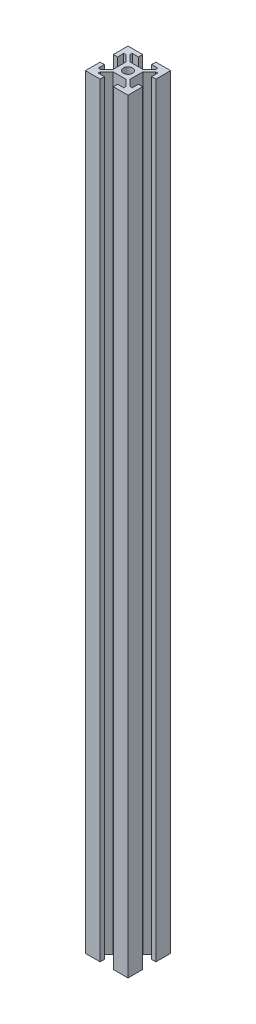
from build123d import *

# Parameters (mm, degrees)
SKETCH_1_R          = 2.15
EXTRUDE_1_DEPTH     = 359
SKETCH_3_R          = 3
CUT_EXTRUDE_1_DEPTH = 26


with BuildPart() as part:
    # 스케치1 → 보스-돌출1 (new body)
    with BuildSketch(Plane(origin=(0, 0, 0), x_dir=(1, 0, 0), z_dir=(0, 1, 0))):
        Polygon((3.1, 8), (6, 8), (6, 7), (3, 4), (0, 4), (-3, 4), (-6, 7), (-6, 8), (-3.1, 8), (-3.1, 9.998992087), (-10.001007855, 9.998992087), (-10.001007855, 3.1), (-8, 3.1), (-8, 6), (-7, 6), (-4, 3), (-4, 0), (-4, -3), (-7, -6), (-8, -6), (-8, -3.1), (-10.001007855, -3.1), (-10.001007855, -9.998992087), (-3.1, -9.998992087), (-3.1, -8), (-6, -8), (-6, -7), (-3, -4), (0, -4), (3, -4), (6, -7), (6, -8), (3.1, -8), (3.1, -9.998992087), (10.001007855, -9.998992087), (10.001007855, -3.1), (8, -3.1), (8, -6), (7, -6), (4, -3), (4, 0), (4, 3), (7, 6), (8, 6), (8, 3.1), (10.001007855, 3.1), (10.001007855, 9.998992087), (3.1, 9.998992087), align=None)
        with Locations(Location((0, 0, 0), (0, 0, 270))):
            Circle(SKETCH_1_R, mode=Mode.SUBTRACT)
    extrude(amount=EXTRUDE_1_DEPTH)

    # 스케치3 → 컷-돌출1 (cut)
    with BuildSketch(Plane(origin=(10.001007855, 0, 0), x_dir=(0, 0, -1), z_dir=(1, 0, 0))):
        with Locations((0, 179.5)):
            Circle(SKETCH_3_R)
    extrude(amount=-CUT_EXTRUDE_1_DEPTH, mode=Mode.SUBTRACT)


solid = part.part
